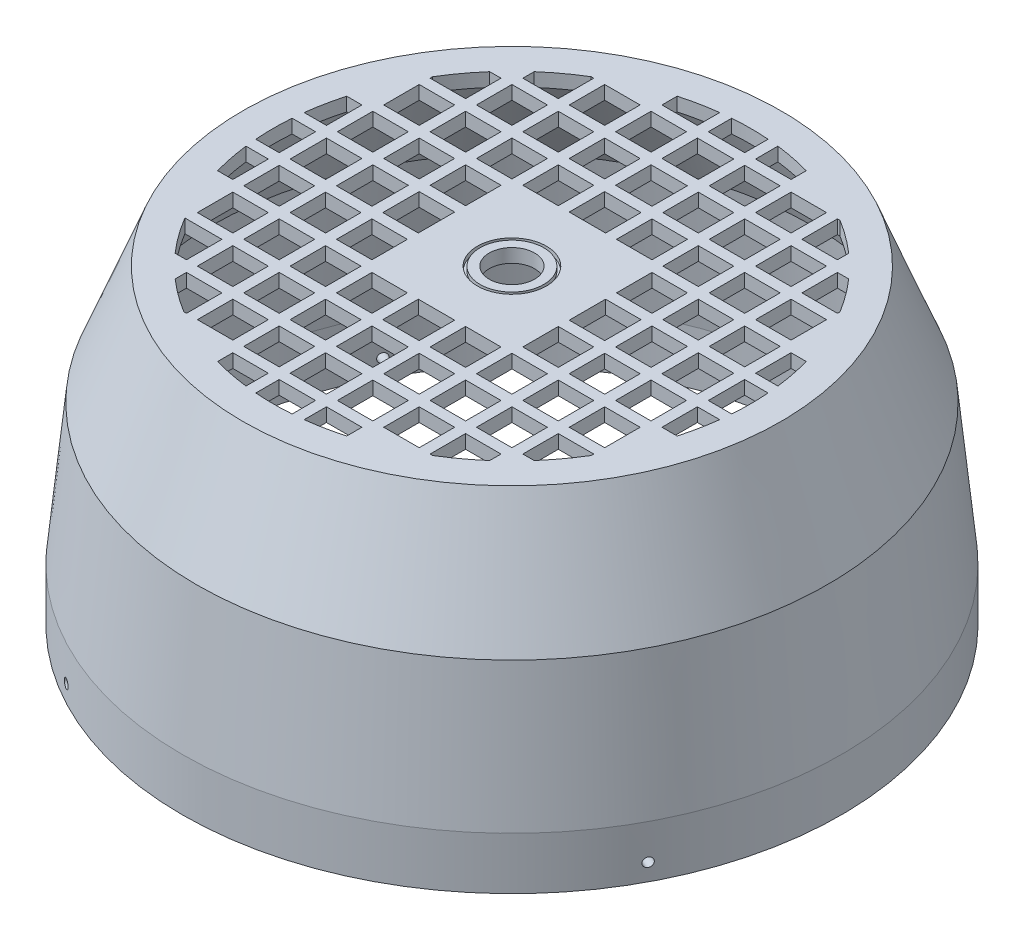
from build123d import *

# Parameters (mm, degrees)
SKETCH2_R           = 7.6
SKETCH2_R_2         = 7
CUT_EXTRUDE2_DEPTH  = 1
SKETCH4_W           = 7.8
SKETCH4_H           = 7.8
SKETCH4_W_2         = 8
SKETCH4_H_2         = 8
CUT_EXTRUDE6_DEPTH  = 124.196550276
SKETCH5_R           = 5
CUT_EXTRUDE7_DEPTH  = 124.196550276
SKETCH10_R          = 1
CUT_EXTRUDE14_DEPTH = 10
CIRPATTERN2_COUNT   = 4


with BuildPart() as part:
    # Sketch1 → Revolve3 (revolve)
    with BuildSketch(Plane.XY, mode=Mode.PRIVATE) as revolve3_sk:
        Polygon((-69.5, 0), (-72.5, 0), (-72.5, 11.5), (-69.4, 42.3), (-59.2, 68.3), (0, 68.3), (0, 65.3), (-57.28706935, 65.3), (-66.4, 42.675119526), (-69.5, 11.875119526), align=None)
    revolve(revolve3_sk.sketch.rotate(Axis((0, 77.073723383, 0), (0, -1, 0)), 270), axis=Axis((0, 77.073723383, 0), (0, -1, 0)))

    # Sketch2 → Cut-Extrude2 (cut)
    with BuildSketch(Plane(origin=(0, 68.3, 0), x_dir=(1, 0, 0), z_dir=(0, 1, 0))):
        with Locations(Location((0, 0, 0), (0, 0, 270))):
            Circle(SKETCH2_R)
        with Locations(Location((0, 0, 0), (0, 0, 270))):
            Circle(SKETCH2_R_2, mode=Mode.SUBTRACT)
    extrude(amount=-CUT_EXTRUDE2_DEPTH, mode=Mode.SUBTRACT)

    # Sketch4 → Cut-Extrude6 (cut, through all)
    with BuildSketch(Plane(origin=(0, 68.3, 0), x_dir=(1, 0, 0), z_dir=(0, 1, 0))):
        with BuildLine():
            Line((-26.8, 37), (-26.8, 44.8))
            Line((-26.8, 44.8), (-27.371700714, 44.8))
            ThreePointArc((-27.371700714, 44.8), (-31.09958834, 42.297347495), (-34.6, 39.485313725))
            Line((-34.6, 39.485313725), (-34.6, 37))
            Line((-34.6, 37), (-26.8, 37))
        make_face()
        with Locations((-20.5, 40.9)):
            Rectangle(SKETCH4_W, SKETCH4_H)
        with Locations((-10.3, 40.9)):
            Rectangle(SKETCH4_W, SKETCH4_H)
        with Locations((0, 40.9)):
            Rectangle(SKETCH4_W_2, SKETCH4_H)
        with Locations((10.3, 40.9)):
            Rectangle(SKETCH4_W, SKETCH4_H)
        with Locations((20.5, 40.9)):
            Rectangle(SKETCH4_W, SKETCH4_H)
        with BuildLine():
            ThreePointArc((34.6, 39.485313725), (31.09958834, 42.297347495), (27.371700714, 44.8))
            Line((27.371700714, 44.8), (26.8, 44.8))
            Line((26.8, 44.8), (26.8, 37))
            Line((26.8, 37), (34.6, 37))
            Line((34.6, 37), (34.6, 39.485313725))
        make_face()
        with BuildLine():
            ThreePointArc((14.2, 50.543149882), (10.329692004, 51.47375509), (6.4, 52.108444613))
            Line((6.4, 52.108444613), (6.4, 47.2))
            Line((6.4, 47.2), (14.2, 47.2))
            Line((14.2, 47.2), (14.2, 50.543149882))
        make_face()
        with BuildLine():
            ThreePointArc((4, 52.347397261), (0, 52.5), (-4, 52.347397261))
            Line((-4, 52.347397261), (-4, 47.2))
            Line((-4, 47.2), (4, 47.2))
            Line((4, 47.2), (4, 52.347397261))
        make_face()
        with BuildLine():
            ThreePointArc((-6.4, 52.108444613), (-10.329692004, 51.47375509), (-14.2, 50.543149882))
            Line((-14.2, 50.543149882), (-14.2, 47.2))
            Line((-14.2, 47.2), (-6.4, 47.2))
            Line((-6.4, 47.2), (-6.4, 52.108444613))
        make_face()
        with BuildLine():
            Line((-37, 34.6), (-39.485313725, 34.6))
            ThreePointArc((-39.485313725, 34.6), (-42.297347495, 31.09958834), (-44.8, 27.371700714))
            Line((-44.8, 27.371700714), (-44.8, 26.8))
            Line((-44.8, 26.8), (-37, 26.8))
            Line((-37, 26.8), (-37, 34.6))
        make_face()
        with Locations((-30.7, 30.7)):
            Rectangle(SKETCH4_W, SKETCH4_H)
        with Locations((-20.5, 30.7)):
            Rectangle(SKETCH4_W, SKETCH4_H)
        with Locations((-10.3, 30.7)):
            Rectangle(SKETCH4_W, SKETCH4_H)
        with Locations((0, 30.7)):
            Rectangle(SKETCH4_W_2, SKETCH4_H)
        with Locations((10.3, 30.7)):
            Rectangle(SKETCH4_W, SKETCH4_H)
        with Locations((20.5, 30.7)):
            Rectangle(SKETCH4_W, SKETCH4_H)
        with Locations((30.7, 30.7)):
            Rectangle(SKETCH4_W, SKETCH4_H)
        with BuildLine():
            ThreePointArc((44.8, 27.371700714), (42.297347495, 31.09958834), (39.485313725, 34.6))
            Line((39.485313725, 34.6), (37, 34.6))
            Line((37, 34.6), (37, 26.8))
            Line((37, 26.8), (44.8, 26.8))
            Line((44.8, 26.8), (44.8, 27.371700714))
        make_face()
        with Locations((40.9, 20.5)):
            Rectangle(SKETCH4_W, SKETCH4_H)
        with Locations((30.7, 20.5)):
            Rectangle(SKETCH4_W, SKETCH4_H)
        with Locations((20.5, 20.5)):
            Rectangle(SKETCH4_W, SKETCH4_H)
        with Locations((10.3, 20.5)):
            Rectangle(SKETCH4_W, SKETCH4_H)
        with Locations((0, 20.5)):
            Rectangle(SKETCH4_W_2, SKETCH4_H)
        with Locations((-10.3, 20.5)):
            Rectangle(SKETCH4_W, SKETCH4_H)
        with Locations((-20.5, 20.5)):
            Rectangle(SKETCH4_W, SKETCH4_H)
        with Locations((-30.7, 20.5)):
            Rectangle(SKETCH4_W, SKETCH4_H)
        with Locations((-40.9, 20.5)):
            Rectangle(SKETCH4_W, SKETCH4_H)
        with BuildLine():
            Line((-47.2, 14.2), (-50.543149882, 14.2))
            ThreePointArc((-50.543149882, 14.2), (-51.47375509, 10.329692004), (-52.108444613, 6.4))
            Line((-52.108444613, 6.4), (-47.2, 6.4))
            Line((-47.2, 6.4), (-47.2, 14.2))
        make_face()
        with Locations((-40.9, 10.3)):
            Rectangle(SKETCH4_W, SKETCH4_H)
        with Locations((-30.7, 10.3)):
            Rectangle(SKETCH4_W, SKETCH4_H)
        with Locations((-20.5, 10.3)):
            Rectangle(SKETCH4_W, SKETCH4_H)
        with Locations((20.5, 10.3)):
            Rectangle(SKETCH4_W, SKETCH4_H)
        with Locations((30.7, 10.3)):
            Rectangle(SKETCH4_W, SKETCH4_H)
        with Locations((40.9, 10.3)):
            Rectangle(SKETCH4_W, SKETCH4_H)
        with BuildLine():
            ThreePointArc((52.108444613, 6.4), (51.47375509, 10.329692004), (50.543149882, 14.2))
            Line((50.543149882, 14.2), (47.2, 14.2))
            Line((47.2, 14.2), (47.2, 6.4))
            Line((47.2, 6.4), (52.108444613, 6.4))
        make_face()
        with Locations((-40.9, -20.5)):
            Rectangle(SKETCH4_W, SKETCH4_H)
        with Locations((-40.9, 0)):
            Rectangle(SKETCH4_W, SKETCH4_H_2)
        with Locations((-30.7, 0)):
            Rectangle(SKETCH4_W, SKETCH4_H_2)
        with Locations((-20.5, 0)):
            Rectangle(SKETCH4_W, SKETCH4_H_2)
        with BuildLine():
            Line((-47.2, 4), (-52.347397261, 4))
            ThreePointArc((-52.347397261, 4), (-52.5, 0), (-52.347397261, -4))
            Line((-52.347397261, -4), (-47.2, -4))
            Line((-47.2, -4), (-47.2, 4))
        make_face()
        with BuildLine():
            Line((-47.2, -6.4), (-52.108444613, -6.4))
            ThreePointArc((-52.108444613, -6.4), (-51.47375509, -10.329692004), (-50.543149882, -14.2))
            Line((-50.543149882, -14.2), (-47.2, -14.2))
            Line((-47.2, -14.2), (-47.2, -6.4))
        make_face()
        with Locations((-40.9, -10.3)):
            Rectangle(SKETCH4_W, SKETCH4_H)
        with Locations((-30.7, -10.3)):
            Rectangle(SKETCH4_W, SKETCH4_H)
        with Locations((-20.5, -10.3)):
            Rectangle(SKETCH4_W, SKETCH4_H)
        with Locations((-30.7, -20.5)):
            Rectangle(SKETCH4_W, SKETCH4_H)
        with Locations((-20.5, -20.5)):
            Rectangle(SKETCH4_W, SKETCH4_H)
        with Locations((0, -20.5)):
            Rectangle(SKETCH4_W_2, SKETCH4_H)
        with Locations((-10.3, -20.5)):
            Rectangle(SKETCH4_W, SKETCH4_H)
        with Locations((20.5, -10.3)):
            Rectangle(SKETCH4_W, SKETCH4_H)
        with Locations((20.5, 0)):
            Rectangle(SKETCH4_W, SKETCH4_H_2)
        with Locations((30.7, 0)):
            Rectangle(SKETCH4_W, SKETCH4_H_2)
        with Locations((30.7, -10.3)):
            Rectangle(SKETCH4_W, SKETCH4_H)
        with Locations((40.9, 0)):
            Rectangle(SKETCH4_W, SKETCH4_H_2)
        with Locations((40.9, -10.3)):
            Rectangle(SKETCH4_W, SKETCH4_H)
        with BuildLine():
            ThreePointArc((52.5, 0), (52.461835444, 2.001454946), (52.347397261, 4))
            Line((52.347397261, 4), (47.2, 4))
            Line((47.2, 4), (47.2, -4))
            Line((47.2, -4), (52.347397261, -4))
            ThreePointArc((52.347397261, -4), (52.461835444, -2.001454946), (52.5, 0))
        make_face()
        with BuildLine():
            ThreePointArc((50.543149882, -14.2), (51.47375509, -10.329692004), (52.108444613, -6.4))
            Line((52.108444613, -6.4), (47.2, -6.4))
            Line((47.2, -6.4), (47.2, -14.2))
            Line((47.2, -14.2), (50.543149882, -14.2))
        make_face()
        with Locations((10.3, -20.5)):
            Rectangle(SKETCH4_W, SKETCH4_H)
        with Locations((20.5, -20.5)):
            Rectangle(SKETCH4_W, SKETCH4_H)
        with Locations((30.7, -20.5)):
            Rectangle(SKETCH4_W, SKETCH4_H)
        with Locations((30.7, -30.7)):
            Rectangle(SKETCH4_W, SKETCH4_H)
        with Locations((20.5, -30.7)):
            Rectangle(SKETCH4_W, SKETCH4_H)
        with Locations((10.3, -30.7)):
            Rectangle(SKETCH4_W, SKETCH4_H)
        with Locations((0, -30.7)):
            Rectangle(SKETCH4_W_2, SKETCH4_H)
        with BuildLine():
            Line((-37, -26.8), (-45.144324117, -26.8))
            ThreePointArc((-45.144324117, -26.8), (-42.494163133, -30.830116764), (-39.485313725, -34.6))
            Line((-39.485313725, -34.6), (-37, -34.6))
            Line((-37, -34.6), (-37, -26.8))
        make_face()
        with Locations((-20.5, -40.9)):
            Rectangle(SKETCH4_W, SKETCH4_H)
        with Locations((-10.3, -40.9)):
            Rectangle(SKETCH4_W, SKETCH4_H)
        with Locations((10.3, -40.9)):
            Rectangle(SKETCH4_W, SKETCH4_H)
        with Locations((20.5, -40.9)):
            Rectangle(SKETCH4_W, SKETCH4_H)
        with BuildLine():
            ThreePointArc((27.371700714, -44.8), (31.09958834, -42.297347495), (34.6, -39.485313725))
            Line((34.6, -39.485313725), (34.6, -37))
            Line((34.6, -37), (26.8, -37))
            Line((26.8, -37), (26.8, -44.8))
            Line((26.8, -44.8), (27.371700714, -44.8))
        make_face()
        with Locations((-10.3, -30.7)):
            Rectangle(SKETCH4_W, SKETCH4_H)
        with Locations((-20.5, -30.7)):
            Rectangle(SKETCH4_W, SKETCH4_H)
        with BuildLine():
            Line((-14.2, -47.2), (-14.2, -50.543149882))
            ThreePointArc((-14.2, -50.543149882), (-10.329692004, -51.47375509), (-6.4, -52.108444613))
            Line((-6.4, -52.108444613), (-6.4, -47.2))
            Line((-6.4, -47.2), (-14.2, -47.2))
        make_face()
        with BuildLine():
            Line((-4, -47.2), (-4, -52.347397261))
            ThreePointArc((-4, -52.347397261), (0, -52.5), (4, -52.347397261))
            Line((4, -52.347397261), (4, -47.2))
            Line((4, -47.2), (-4, -47.2))
        make_face()
        with BuildLine():
            Line((6.4, -47.2), (6.4, -52.108444613))
            ThreePointArc((6.4, -52.108444613), (10.329692004, -51.47375509), (14.2, -50.543149882))
            Line((14.2, -50.543149882), (14.2, -47.2))
            Line((14.2, -47.2), (6.4, -47.2))
        make_face()
        with BuildLine():
            ThreePointArc((39.485313725, -34.6), (42.297347495, -31.09958834), (44.8, -27.371700714))
            Line((44.8, -27.371700714), (44.8, -26.8))
            Line((44.8, -26.8), (37, -26.8))
            Line((37, -26.8), (37, -34.6))
            Line((37, -34.6), (39.485313725, -34.6))
        make_face()
        with Locations((40.9, -20.5)):
            Rectangle(SKETCH4_W, SKETCH4_H)
        with BuildLine():
            Line((-34.6, -37), (-34.6, -39.485313725))
            ThreePointArc((-34.6, -39.485313725), (-31.09958834, -42.297347495), (-27.371700714, -44.8))
            Line((-27.371700714, -44.8), (-26.8, -44.8))
            Line((-26.8, -44.8), (-26.8, -37))
            Line((-26.8, -37), (-34.6, -37))
        make_face()
        with Locations((-30.7, -30.7)):
            Rectangle(SKETCH4_W, SKETCH4_H)
        with Locations((0, -40.9)):
            Rectangle(SKETCH4_W_2, SKETCH4_H)
    extrude(amount=-CUT_EXTRUDE6_DEPTH, mode=Mode.SUBTRACT)

    # Sketch5 → Cut-Extrude7 (cut, through all)
    with BuildSketch(Plane(origin=(0, 68.3, 0), x_dir=(1, 0, 0), z_dir=(0, 1, 0))):
        with Locations(Location((0, 0, 0), (0, 0, 270))):
            Circle(SKETCH5_R)
    extrude(amount=-CUT_EXTRUDE7_DEPTH, mode=Mode.SUBTRACT)

    # Sketch10 → Cut-Extrude14 (cut)
    with BuildSketch(Plane(origin=(27.684351141, 0, -63.202663725), x_dir=(-0.9159806336939282, 0, -0.4012224802994836), z_dir=(-0.40122248029948365, 0, 0.9159806336939283))):
        with Locations(Location((-5.5, -3.75810827, 0), (0, 0, 180))):
            Circle(SKETCH10_R)
    cut_extrude14 = extrude(amount=-CUT_EXTRUDE14_DEPTH, mode=Mode.SUBTRACT)

    # CirPattern2: Cut-Extrude14 ×4 about axis
    cirpattern2_axis = Axis((0, 0, 0), (0, 1, 0))
    for i in range(1, CIRPATTERN2_COUNT):
        add(cut_extrude14.rotate(cirpattern2_axis, i * 360 / CIRPATTERN2_COUNT), mode=Mode.SUBTRACT)


solid = part.part
